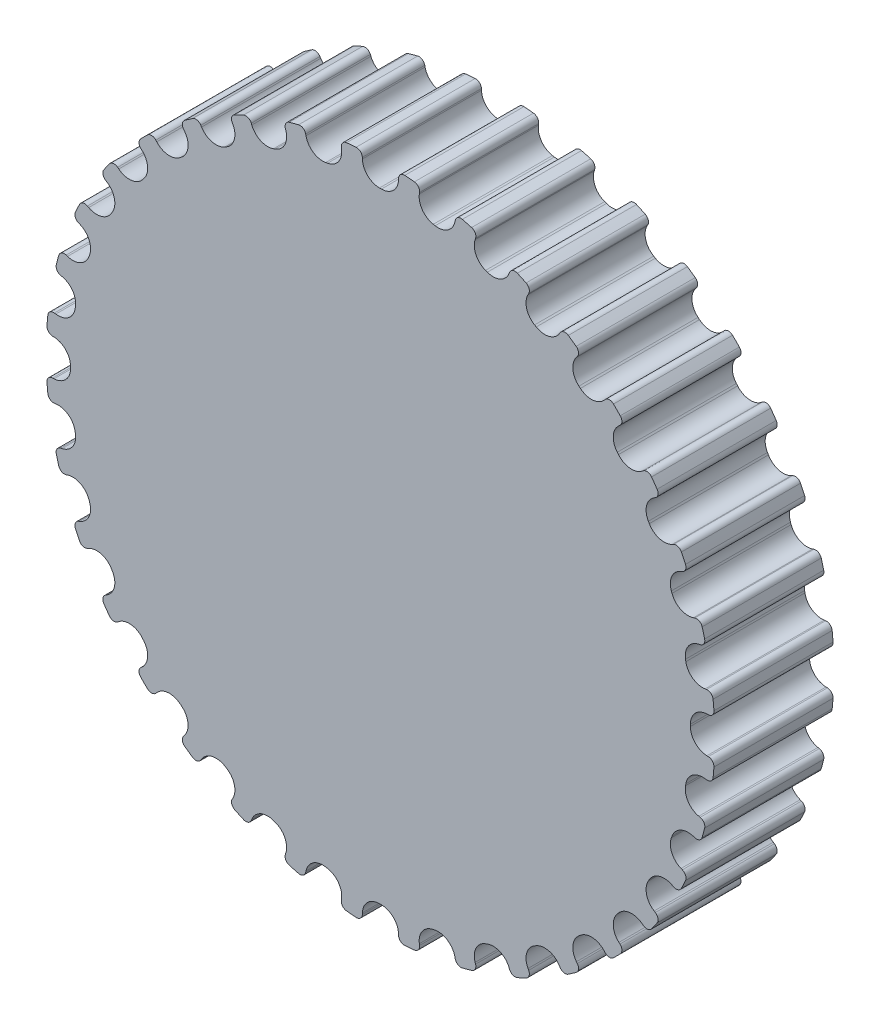
from build123d import *

# Parameters (mm, degrees)
EXTRUDE_7817_DEPTH = 5


with BuildPart() as part:
    # 草图1 → Extrude 7817 (new, symmetric)
    with BuildSketch(Plane.XY):
        with BuildLine():
            Line((0.081, 26.023889757), (-0.081, 26.023889757))
            ThreePointArc((-0.081, 26.023889757), (-1.079918737, 26.427479124), (-1.518124009, 27.41170428))
            Line((-1.518124009, 27.41170428), (-1.522310858, 27.531599943))
            ThreePointArc((-1.522310858, 27.531599943), (-1.684042167, 27.877730986), (-2.045568553, 28.001272023))
            ThreePointArc((-2.045568553, 28.001272023), (-2.219797894, 27.987998909), (-2.393941254, 27.973641717))
            ThreePointArc((-2.393941254, 27.973641717), (-2.446975025, 27.96905252), (-2.5, 27.964362779))
            ThreePointArc((-2.5, 27.964362779), (-2.673990831, 27.948262176), (-2.847878089, 27.931079034))
            ThreePointArc((-2.847878089, 27.931079034), (-3.182459401, 27.746636465), (-3.281628623, 27.377679583))
            Line((-3.281628623, 27.377679583), (-3.264932201, 27.258878366))
            ThreePointArc((-3.264932201, 27.258878366), (-3.525571246, 26.213512254), (-4.439231604, 25.642593898))
            Line((-4.439231604, 25.642593898), (-4.59877046, 25.614462893))
            ThreePointArc((-4.59877046, 25.614462893), (-5.652595935, 25.838460413), (-6.255052789, 26.731639431))
            Line((-6.255052789, 26.731639431), (-6.279995694, 26.84898657))
            ThreePointArc((-6.279995694, 26.84898657), (-6.499374966, 27.161774758), (-6.876861629, 27.220660531))
            ThreePointArc((-6.876861629, 27.220660531), (-7.046139183, 27.177334458), (-7.215143814, 27.132955706))
            ThreePointArc((-7.215143814, 27.132955706), (-7.266574977, 27.119227012), (-7.317980019, 27.105400828))
            ThreePointArc((-7.317980019, 27.105400828), (-7.486531698, 27.059331639), (-7.654793396, 27.012214342))
            ThreePointArc((-7.654793396, 27.012214342), (-7.95226355, 26.772474435), (-7.985857479, 26.391902283))
            Line((-7.985857479, 26.391902283), (-7.948785098, 26.277805227))
            ThreePointArc((-7.948785098, 26.277805227), (-8.02393853, 25.20306108), (-8.824579402, 24.4821608))
            Line((-8.824579402, 24.4821608), (-8.976809607, 24.426753537))
            ThreePointArc((-8.976809607, 24.426753537), (-10.053521866, 24.464353157), (-10.801924956, 25.239347244))
            Line((-10.801924956, 25.239347244), (-10.846866038, 25.350580327))
            ThreePointArc((-10.846866038, 25.350580327), (-11.117227545, 25.620521749), (-11.499204745, 25.612963043))
            ThreePointArc((-11.499204745, 25.612963043), (-11.658387099, 25.540900452), (-11.81711788, 25.467848567))
            ThreePointArc((-11.81711788, 25.467848567), (-11.865383726, 25.445397514), (-11.913606918, 25.42285499))
            ThreePointArc((-11.913606918, 25.42285499), (-12.071598087, 25.348217003), (-12.22912168, 25.272597187))
            ThreePointArc((-12.22912168, 25.272597187), (-12.480442196, 24.984844318), (-12.447440096, 24.604220386))
            Line((-12.447440096, 24.604220386), (-12.391118182, 24.498294272))
            ThreePointArc((-12.391118182, 24.498294272), (-12.278502502, 23.426827647), (-12.941796821, 22.577849634))
            Line((-12.941796821, 22.577849634), (-13.082092936, 22.496849634))
            ThreePointArc((-13.082092936, 22.496849634), (-14.148976622, 22.346908911), (-15.020586098, 22.980170263))
            Line((-15.020586098, 22.980170263), (-15.084159847, 23.081909528))
            ThreePointArc((-15.084159847, 23.081909528), (-15.397288791, 23.300802151), (-15.772150344, 23.227028634))
            ThreePointArc((-15.772150344, 23.227028634), (-15.916400822, 23.128419109), (-16.060034799, 23.028913736))
            ThreePointArc((-16.060034799, 23.028913736), (-16.103668794, 22.998422489), (-16.147244899, 22.967848567))
            ThreePointArc((-16.147244899, 22.967848567), (-16.289875077, 22.86690962), (-16.431874289, 22.765084954))
            ThreePointArc((-16.431874289, 22.765084954), (-16.62940892, 22.438062348), (-16.530813545, 22.068951704))
            Line((-16.530813545, 22.068951704), (-16.456953411, 21.974415043))
            ThreePointArc((-16.456953411, 21.974415043), (-16.159990389, 20.938781912), (-16.665784291, 19.987521933))
            Line((-16.665784291, 19.987521933), (-16.789883491, 19.88339034))
            ThreePointArc((-16.789883491, 19.88339034), (-17.814521883, 19.550465145), (-18.782854333, 20.022752437))
            Line((-18.782854333, 20.022752437), (-18.863129092, 20.111906589))
            ThreePointArc((-18.863129092, 20.111906589), (-19.209511208, 20.27309947), (-19.565867135, 20.135352713))
            ThreePointArc((-19.565867135, 20.135352713), (-19.69080276, 20.013192456), (-19.814975688, 19.890257015))
            ThreePointArc((-19.814975688, 19.890257015), (-19.852652035, 19.852652035), (-19.890257015, 19.814975688))
            ThreePointArc((-19.890257015, 19.814975688), (-20.013192456, 19.69080276), (-20.135352713, 19.565867135))
            ThreePointArc((-20.135352713, 19.565867135), (-20.27309947, 19.209511208), (-20.111906589, 18.863129092))
            Line((-20.111906589, 18.863129092), (-20.022752437, 18.782854333))
            ThreePointArc((-20.022752437, 18.782854333), (-19.550465145, 17.814521883), (-19.88339034, 16.789883491))
            Line((-19.88339034, 16.789883491), (-19.987521933, 16.665784291))
            ThreePointArc((-19.987521933, 16.665784291), (-20.938781912, 16.159990389), (-21.974415043, 16.456953411))
            Line((-21.974415043, 16.456953411), (-22.068951704, 16.530813545))
            ThreePointArc((-22.068951704, 16.530813545), (-22.438062348, 16.62940892), (-22.765084954, 16.431874289))
            ThreePointArc((-22.765084954, 16.431874289), (-22.86690962, 16.289875077), (-22.967848567, 16.147244899))
            ThreePointArc((-22.967848567, 16.147244899), (-22.998422489, 16.103668794), (-23.028913736, 16.060034799))
            ThreePointArc((-23.028913736, 16.060034799), (-23.128419109, 15.916400822), (-23.227028634, 15.772150344))
            ThreePointArc((-23.227028634, 15.772150344), (-23.300802151, 15.397288791), (-23.081909528, 15.084159847))
            Line((-23.081909528, 15.084159847), (-22.980170263, 15.020586098))
            ThreePointArc((-22.980170263, 15.020586098), (-22.346908911, 14.148976622), (-22.496849634, 13.082092936))
            Line((-22.496849634, 13.082092936), (-22.577849634, 12.941796821))
            ThreePointArc((-22.577849634, 12.941796821), (-23.426827647, 12.278502502), (-24.498294272, 12.391118182))
            Line((-24.498294272, 12.391118182), (-24.604220386, 12.447440096))
            ThreePointArc((-24.604220386, 12.447440096), (-24.984844318, 12.480442196), (-25.272597187, 12.22912168))
            ThreePointArc((-25.272597187, 12.22912168), (-25.348217003, 12.071598087), (-25.42285499, 11.913606918))
            ThreePointArc((-25.42285499, 11.913606918), (-25.445397514, 11.865383726), (-25.467848567, 11.81711788))
            ThreePointArc((-25.467848567, 11.81711788), (-25.540900452, 11.658387099), (-25.612963043, 11.499204745))
            ThreePointArc((-25.612963043, 11.499204745), (-25.620521749, 11.117227545), (-25.350580327, 10.846866038))
            Line((-25.350580327, 10.846866038), (-25.239347244, 10.801924956))
            ThreePointArc((-25.239347244, 10.801924956), (-24.464353157, 10.053521866), (-24.426753537, 8.976809607))
            Line((-24.426753537, 8.976809607), (-24.4821608, 8.824579402))
            ThreePointArc((-24.4821608, 8.824579402), (-25.20306108, 8.02393853), (-26.277805227, 7.948785098))
            Line((-26.277805227, 7.948785098), (-26.391902283, 7.985857479))
            ThreePointArc((-26.391902283, 7.985857479), (-26.772474435, 7.95226355), (-27.012214342, 7.654793396))
            ThreePointArc((-27.012214342, 7.654793396), (-27.059331639, 7.486531698), (-27.105400828, 7.317980019))
            ThreePointArc((-27.105400828, 7.317980019), (-27.119227012, 7.266574977), (-27.132955706, 7.215143814))
            ThreePointArc((-27.132955706, 7.215143814), (-27.177334458, 7.046139183), (-27.220660531, 6.876861629))
            ThreePointArc((-27.220660531, 6.876861629), (-27.161774758, 6.499374966), (-26.84898657, 6.279995694))
            Line((-26.84898657, 6.279995694), (-26.731639431, 6.255052789))
            ThreePointArc((-26.731639431, 6.255052789), (-25.838460413, 5.652595935), (-25.614462893, 4.59877046))
            Line((-25.614462893, 4.59877046), (-25.642593898, 4.439231604))
            ThreePointArc((-25.642593898, 4.439231604), (-26.213512254, 3.525571246), (-27.258878366, 3.264932201))
            Line((-27.258878366, 3.264932201), (-27.377679583, 3.281628623))
            ThreePointArc((-27.377679583, 3.281628623), (-27.746636465, 3.182459401), (-27.931079034, 2.847878089))
            ThreePointArc((-27.931079034, 2.847878089), (-27.948262176, 2.673990831), (-27.964362779, 2.5))
            ThreePointArc((-27.964362779, 2.5), (-27.96905252, 2.446975025), (-27.973641717, 2.393941254))
            ThreePointArc((-27.973641717, 2.393941254), (-27.987998909, 2.219797894), (-28.001272023, 2.045568553))
            ThreePointArc((-28.001272023, 2.045568553), (-27.877730986, 1.684042167), (-27.531599943, 1.522310858))
            Line((-27.531599943, 1.522310858), (-27.41170428, 1.518124009))
            ThreePointArc((-27.41170428, 1.518124009), (-26.427479124, 1.079918737), (-26.023889757, 0.081))
            Line((-26.023889757, 0.081), (-26.023889757, -0.081))
            ThreePointArc((-26.023889757, -0.081), (-26.427479124, -1.079918737), (-27.41170428, -1.518124009))
            Line((-27.41170428, -1.518124009), (-27.531599943, -1.522310858))
            ThreePointArc((-27.531599943, -1.522310858), (-27.877730986, -1.684042167), (-28.001272023, -2.045568553))
            ThreePointArc((-28.001272023, -2.045568553), (-27.987998909, -2.219797894), (-27.973641717, -2.393941254))
            ThreePointArc((-27.973641717, -2.393941254), (-27.96905252, -2.446975025), (-27.964362779, -2.5))
            ThreePointArc((-27.964362779, -2.5), (-27.948262176, -2.673990831), (-27.931079034, -2.847878089))
            ThreePointArc((-27.931079034, -2.847878089), (-27.746636465, -3.182459401), (-27.377679583, -3.281628623))
            Line((-27.377679583, -3.281628623), (-27.258878366, -3.264932201))
            ThreePointArc((-27.258878366, -3.264932201), (-26.213512254, -3.525571246), (-25.642593898, -4.439231604))
            Line((-25.642593898, -4.439231604), (-25.614462893, -4.59877046))
            ThreePointArc((-25.614462893, -4.59877046), (-25.838460413, -5.652595935), (-26.731639431, -6.255052789))
            Line((-26.731639431, -6.255052789), (-26.84898657, -6.279995694))
            ThreePointArc((-26.84898657, -6.279995694), (-27.161774758, -6.499374966), (-27.220660531, -6.876861629))
            ThreePointArc((-27.220660531, -6.876861629), (-27.177334458, -7.046139183), (-27.132955706, -7.215143814))
            ThreePointArc((-27.132955706, -7.215143814), (-27.119227012, -7.266574977), (-27.105400828, -7.317980019))
            ThreePointArc((-27.105400828, -7.317980019), (-27.059331639, -7.486531698), (-27.012214342, -7.654793396))
            ThreePointArc((-27.012214342, -7.654793396), (-26.772474435, -7.95226355), (-26.391902283, -7.985857479))
            Line((-26.391902283, -7.985857479), (-26.277805227, -7.948785098))
            ThreePointArc((-26.277805227, -7.948785098), (-25.20306108, -8.02393853), (-24.4821608, -8.824579402))
            Line((-24.4821608, -8.824579402), (-24.426753537, -8.976809607))
            ThreePointArc((-24.426753537, -8.976809607), (-24.464353157, -10.053521866), (-25.239347244, -10.801924956))
            Line((-25.239347244, -10.801924956), (-25.350580327, -10.846866038))
            ThreePointArc((-25.350580327, -10.846866038), (-25.620521749, -11.117227545), (-25.612963043, -11.499204745))
            ThreePointArc((-25.612963043, -11.499204745), (-25.540900452, -11.658387099), (-25.467848567, -11.81711788))
            ThreePointArc((-25.467848567, -11.81711788), (-25.445397514, -11.865383726), (-25.42285499, -11.913606918))
            ThreePointArc((-25.42285499, -11.913606918), (-25.348217003, -12.071598087), (-25.272597187, -12.22912168))
            ThreePointArc((-25.272597187, -12.22912168), (-24.984844318, -12.480442196), (-24.604220386, -12.447440096))
            Line((-24.604220386, -12.447440096), (-24.498294272, -12.391118182))
            ThreePointArc((-24.498294272, -12.391118182), (-23.426827647, -12.278502502), (-22.577849634, -12.941796821))
            Line((-22.577849634, -12.941796821), (-22.496849634, -13.082092936))
            ThreePointArc((-22.496849634, -13.082092936), (-22.346908911, -14.148976622), (-22.980170263, -15.020586098))
            Line((-22.980170263, -15.020586098), (-23.081909528, -15.084159847))
            ThreePointArc((-23.081909528, -15.084159847), (-23.300802151, -15.397288791), (-23.227028634, -15.772150344))
            ThreePointArc((-23.227028634, -15.772150344), (-23.128419109, -15.916400822), (-23.028913736, -16.060034799))
            ThreePointArc((-23.028913736, -16.060034799), (-22.998422489, -16.103668794), (-22.967848567, -16.147244899))
            ThreePointArc((-22.967848567, -16.147244899), (-22.86690962, -16.289875077), (-22.765084954, -16.431874289))
            ThreePointArc((-22.765084954, -16.431874289), (-22.438062348, -16.62940892), (-22.068951704, -16.530813545))
            Line((-22.068951704, -16.530813545), (-21.974415043, -16.456953411))
            ThreePointArc((-21.974415043, -16.456953411), (-20.938781912, -16.159990389), (-19.987521933, -16.665784291))
            Line((-19.987521933, -16.665784291), (-19.88339034, -16.789883491))
            ThreePointArc((-19.88339034, -16.789883491), (-19.550465145, -17.814521883), (-20.022752437, -18.782854333))
            Line((-20.022752437, -18.782854333), (-20.111906589, -18.863129092))
            ThreePointArc((-20.111906589, -18.863129092), (-20.27309947, -19.209511208), (-20.135352713, -19.565867135))
            ThreePointArc((-20.135352713, -19.565867135), (-20.013192456, -19.69080276), (-19.890257015, -19.814975688))
            ThreePointArc((-19.890257015, -19.814975688), (-19.852652035, -19.852652035), (-19.814975688, -19.890257015))
            ThreePointArc((-19.814975688, -19.890257015), (-19.69080276, -20.013192456), (-19.565867135, -20.135352713))
            ThreePointArc((-19.565867135, -20.135352713), (-19.209511208, -20.27309947), (-18.863129092, -20.111906589))
            Line((-18.863129092, -20.111906589), (-18.782854333, -20.022752437))
            ThreePointArc((-18.782854333, -20.022752437), (-17.814521883, -19.550465145), (-16.789883491, -19.88339034))
            Line((-16.789883491, -19.88339034), (-16.665784291, -19.987521933))
            ThreePointArc((-16.665784291, -19.987521933), (-16.159990389, -20.938781912), (-16.456953411, -21.974415043))
            Line((-16.456953411, -21.974415043), (-16.530813545, -22.068951704))
            ThreePointArc((-16.530813545, -22.068951704), (-16.62940892, -22.438062348), (-16.431874289, -22.765084954))
            ThreePointArc((-16.431874289, -22.765084954), (-16.289875077, -22.86690962), (-16.147244899, -22.967848567))
            ThreePointArc((-16.147244899, -22.967848567), (-16.103668794, -22.998422489), (-16.060034799, -23.028913736))
            ThreePointArc((-16.060034799, -23.028913736), (-15.916400822, -23.128419109), (-15.772150344, -23.227028634))
            ThreePointArc((-15.772150344, -23.227028634), (-15.397288791, -23.300802151), (-15.084159847, -23.081909528))
            Line((-15.084159847, -23.081909528), (-15.020586098, -22.980170263))
            ThreePointArc((-15.020586098, -22.980170263), (-14.148976622, -22.346908911), (-13.082092936, -22.496849634))
            Line((-13.082092936, -22.496849634), (-12.941796821, -22.577849634))
            ThreePointArc((-12.941796821, -22.577849634), (-12.278502502, -23.426827647), (-12.391118182, -24.498294272))
            Line((-12.391118182, -24.498294272), (-12.447440096, -24.604220386))
            ThreePointArc((-12.447440096, -24.604220386), (-12.480442196, -24.984844318), (-12.22912168, -25.272597187))
            ThreePointArc((-12.22912168, -25.272597187), (-12.071598087, -25.348217003), (-11.913606918, -25.42285499))
            ThreePointArc((-11.913606918, -25.42285499), (-11.865383726, -25.445397514), (-11.81711788, -25.467848567))
            ThreePointArc((-11.81711788, -25.467848567), (-11.658387099, -25.540900452), (-11.499204745, -25.612963043))
            ThreePointArc((-11.499204745, -25.612963043), (-11.117227545, -25.620521749), (-10.846866038, -25.350580327))
            Line((-10.846866038, -25.350580327), (-10.801924956, -25.239347244))
            ThreePointArc((-10.801924956, -25.239347244), (-10.053521866, -24.464353157), (-8.976809607, -24.426753537))
            Line((-8.976809607, -24.426753537), (-8.824579402, -24.4821608))
            ThreePointArc((-8.824579402, -24.4821608), (-8.02393853, -25.20306108), (-7.948785098, -26.277805227))
            Line((-7.948785098, -26.277805227), (-7.985857479, -26.391902283))
            ThreePointArc((-7.985857479, -26.391902283), (-7.95226355, -26.772474435), (-7.654793396, -27.012214342))
            ThreePointArc((-7.654793396, -27.012214342), (-7.486531698, -27.059331639), (-7.317980019, -27.105400828))
            ThreePointArc((-7.317980019, -27.105400828), (-7.266574977, -27.119227012), (-7.215143814, -27.132955706))
            ThreePointArc((-7.215143814, -27.132955706), (-7.046139183, -27.177334458), (-6.876861629, -27.220660531))
            ThreePointArc((-6.876861629, -27.220660531), (-6.499374966, -27.161774758), (-6.279995694, -26.84898657))
            Line((-6.279995694, -26.84898657), (-6.255052789, -26.731639431))
            ThreePointArc((-6.255052789, -26.731639431), (-5.652595935, -25.838460413), (-4.59877046, -25.614462893))
            Line((-4.59877046, -25.614462893), (-4.439231604, -25.642593898))
            ThreePointArc((-4.439231604, -25.642593898), (-3.525571246, -26.213512254), (-3.264932201, -27.258878366))
            Line((-3.264932201, -27.258878366), (-3.281628623, -27.377679583))
            ThreePointArc((-3.281628623, -27.377679583), (-3.182459401, -27.746636465), (-2.847878089, -27.931079034))
            ThreePointArc((-2.847878089, -27.931079034), (-2.673990831, -27.948262176), (-2.5, -27.964362779))
            ThreePointArc((-2.5, -27.964362779), (-2.446975025, -27.96905252), (-2.393941254, -27.973641717))
            ThreePointArc((-2.393941254, -27.973641717), (-2.219797894, -27.987998909), (-2.045568553, -28.001272023))
            ThreePointArc((-2.045568553, -28.001272023), (-1.684042167, -27.877730986), (-1.522310858, -27.531599943))
            Line((-1.522310858, -27.531599943), (-1.518124009, -27.41170428))
            ThreePointArc((-1.518124009, -27.41170428), (-1.079918737, -26.427479124), (-0.081, -26.023889757))
            Line((-0.081, -26.023889757), (0.081, -26.023889757))
            ThreePointArc((0.081, -26.023889757), (1.079918737, -26.427479124), (1.518124009, -27.41170428))
            Line((1.518124009, -27.41170428), (1.522310858, -27.531599943))
            ThreePointArc((1.522310858, -27.531599943), (1.684042167, -27.877730986), (2.045568553, -28.001272023))
            ThreePointArc((2.045568553, -28.001272023), (2.219797894, -27.987998909), (2.393941254, -27.973641717))
            ThreePointArc((2.393941254, -27.973641717), (2.446975025, -27.96905252), (2.5, -27.964362779))
            ThreePointArc((2.5, -27.964362779), (2.673990831, -27.948262176), (2.847878089, -27.931079034))
            ThreePointArc((2.847878089, -27.931079034), (3.182459401, -27.746636465), (3.281628623, -27.377679583))
            Line((3.281628623, -27.377679583), (3.264932201, -27.258878366))
            ThreePointArc((3.264932201, -27.258878366), (3.525571246, -26.213512254), (4.439231604, -25.642593898))
            Line((4.439231604, -25.642593898), (4.59877046, -25.614462893))
            ThreePointArc((4.59877046, -25.614462893), (5.652595935, -25.838460413), (6.255052789, -26.731639431))
            Line((6.255052789, -26.731639431), (6.279995694, -26.84898657))
            ThreePointArc((6.279995694, -26.84898657), (6.499374966, -27.161774758), (6.876861629, -27.220660531))
            ThreePointArc((6.876861629, -27.220660531), (7.046139183, -27.177334458), (7.215143814, -27.132955706))
            ThreePointArc((7.215143814, -27.132955706), (7.266574977, -27.119227012), (7.317980019, -27.105400828))
            ThreePointArc((7.317980019, -27.105400828), (7.486531698, -27.059331639), (7.654793396, -27.012214342))
            ThreePointArc((7.654793396, -27.012214342), (7.95226355, -26.772474435), (7.985857479, -26.391902283))
            Line((7.985857479, -26.391902283), (7.948785098, -26.277805227))
            ThreePointArc((7.948785098, -26.277805227), (8.02393853, -25.20306108), (8.824579402, -24.4821608))
            Line((8.824579402, -24.4821608), (8.976809607, -24.426753537))
            ThreePointArc((8.976809607, -24.426753537), (10.053521866, -24.464353157), (10.801924956, -25.239347244))
            Line((10.801924956, -25.239347244), (10.846866038, -25.350580327))
            ThreePointArc((10.846866038, -25.350580327), (11.117227545, -25.620521749), (11.499204745, -25.612963043))
            ThreePointArc((11.499204745, -25.612963043), (11.658387099, -25.540900452), (11.81711788, -25.467848567))
            ThreePointArc((11.81711788, -25.467848567), (11.865383726, -25.445397514), (11.913606918, -25.42285499))
            ThreePointArc((11.913606918, -25.42285499), (12.071598087, -25.348217003), (12.22912168, -25.272597187))
            ThreePointArc((12.22912168, -25.272597187), (12.480442196, -24.984844318), (12.447440096, -24.604220386))
            Line((12.447440096, -24.604220386), (12.391118182, -24.498294272))
            ThreePointArc((12.391118182, -24.498294272), (12.278502502, -23.426827647), (12.941796821, -22.577849634))
            Line((12.941796821, -22.577849634), (13.082092936, -22.496849634))
            ThreePointArc((13.082092936, -22.496849634), (14.148976622, -22.346908911), (15.020586098, -22.980170263))
            Line((15.020586098, -22.980170263), (15.084159847, -23.081909528))
            ThreePointArc((15.084159847, -23.081909528), (15.397288791, -23.300802151), (15.772150344, -23.227028634))
            ThreePointArc((15.772150344, -23.227028634), (15.916400822, -23.128419109), (16.060034799, -23.028913736))
            ThreePointArc((16.060034799, -23.028913736), (16.103668794, -22.998422489), (16.147244899, -22.967848567))
            ThreePointArc((16.147244899, -22.967848567), (16.289875077, -22.86690962), (16.431874289, -22.765084954))
            ThreePointArc((16.431874289, -22.765084954), (16.62940892, -22.438062348), (16.530813545, -22.068951704))
            Line((16.530813545, -22.068951704), (16.456953411, -21.974415043))
            ThreePointArc((16.456953411, -21.974415043), (16.159990389, -20.938781912), (16.665784291, -19.987521933))
            Line((16.665784291, -19.987521933), (16.789883491, -19.88339034))
            ThreePointArc((16.789883491, -19.88339034), (17.814521883, -19.550465145), (18.782854333, -20.022752437))
            Line((18.782854333, -20.022752437), (18.863129092, -20.111906589))
            ThreePointArc((18.863129092, -20.111906589), (19.209511208, -20.27309947), (19.565867135, -20.135352713))
            ThreePointArc((19.565867135, -20.135352713), (19.69080276, -20.013192456), (19.814975688, -19.890257015))
            ThreePointArc((19.814975688, -19.890257015), (19.852652035, -19.852652035), (19.890257015, -19.814975688))
            ThreePointArc((19.890257015, -19.814975688), (20.013192456, -19.69080276), (20.135352713, -19.565867135))
            ThreePointArc((20.135352713, -19.565867135), (20.27309947, -19.209511208), (20.111906589, -18.863129092))
            Line((20.111906589, -18.863129092), (20.022752437, -18.782854333))
            ThreePointArc((20.022752437, -18.782854333), (19.550465145, -17.814521883), (19.88339034, -16.789883491))
            Line((19.88339034, -16.789883491), (19.987521933, -16.665784291))
            ThreePointArc((19.987521933, -16.665784291), (20.938781912, -16.159990389), (21.974415043, -16.456953411))
            Line((21.974415043, -16.456953411), (22.068951704, -16.530813545))
            ThreePointArc((22.068951704, -16.530813545), (22.438062348, -16.62940892), (22.765084954, -16.431874289))
            ThreePointArc((22.765084954, -16.431874289), (22.86690962, -16.289875077), (22.967848567, -16.147244899))
            ThreePointArc((22.967848567, -16.147244899), (22.998422489, -16.103668794), (23.028913736, -16.060034799))
            ThreePointArc((23.028913736, -16.060034799), (23.128419109, -15.916400822), (23.227028634, -15.772150344))
            ThreePointArc((23.227028634, -15.772150344), (23.300802151, -15.397288791), (23.081909528, -15.084159847))
            Line((23.081909528, -15.084159847), (22.980170263, -15.020586098))
            ThreePointArc((22.980170263, -15.020586098), (22.346908911, -14.148976622), (22.496849634, -13.082092936))
            Line((22.496849634, -13.082092936), (22.577849634, -12.941796821))
            ThreePointArc((22.577849634, -12.941796821), (23.426827647, -12.278502502), (24.498294272, -12.391118182))
            Line((24.498294272, -12.391118182), (24.604220386, -12.447440096))
            ThreePointArc((24.604220386, -12.447440096), (24.984844318, -12.480442196), (25.272597187, -12.22912168))
            ThreePointArc((25.272597187, -12.22912168), (25.348217003, -12.071598087), (25.42285499, -11.913606918))
            ThreePointArc((25.42285499, -11.913606918), (25.445397514, -11.865383726), (25.467848567, -11.81711788))
            ThreePointArc((25.467848567, -11.81711788), (25.540900452, -11.658387099), (25.612963043, -11.499204745))
            ThreePointArc((25.612963043, -11.499204745), (25.620521749, -11.117227545), (25.350580327, -10.846866038))
            Line((25.350580327, -10.846866038), (25.239347244, -10.801924956))
            ThreePointArc((25.239347244, -10.801924956), (24.464353157, -10.053521866), (24.426753537, -8.976809607))
            Line((24.426753537, -8.976809607), (24.4821608, -8.824579402))
            ThreePointArc((24.4821608, -8.824579402), (25.20306108, -8.02393853), (26.277805227, -7.948785098))
            Line((26.277805227, -7.948785098), (26.391902283, -7.985857479))
            ThreePointArc((26.391902283, -7.985857479), (26.772474435, -7.95226355), (27.012214342, -7.654793396))
            ThreePointArc((27.012214342, -7.654793396), (27.059331639, -7.486531698), (27.105400828, -7.317980019))
            ThreePointArc((27.105400828, -7.317980019), (27.119227012, -7.266574977), (27.132955706, -7.215143814))
            ThreePointArc((27.132955706, -7.215143814), (27.177334458, -7.046139183), (27.220660531, -6.876861629))
            ThreePointArc((27.220660531, -6.876861629), (27.161774758, -6.499374966), (26.84898657, -6.279995694))
            Line((26.84898657, -6.279995694), (26.731639431, -6.255052789))
            ThreePointArc((26.731639431, -6.255052789), (25.838460413, -5.652595935), (25.614462893, -4.59877046))
            Line((25.614462893, -4.59877046), (25.642593898, -4.439231604))
            ThreePointArc((25.642593898, -4.439231604), (26.213512254, -3.525571246), (27.258878366, -3.264932201))
            Line((27.258878366, -3.264932201), (27.377679583, -3.281628623))
            ThreePointArc((27.377679583, -3.281628623), (27.746636465, -3.182459401), (27.931079034, -2.847878089))
            ThreePointArc((27.931079034, -2.847878089), (27.948262176, -2.673990831), (27.964362779, -2.5))
            ThreePointArc((27.964362779, -2.5), (27.96905252, -2.446975025), (27.973641717, -2.393941254))
            ThreePointArc((27.973641717, -2.393941254), (27.987998909, -2.219797894), (28.001272023, -2.045568553))
            ThreePointArc((28.001272023, -2.045568553), (27.877730986, -1.684042167), (27.531599943, -1.522310858))
            Line((27.531599943, -1.522310858), (27.41170428, -1.518124009))
            ThreePointArc((27.41170428, -1.518124009), (26.427479124, -1.079918737), (26.023889757, -0.081))
            Line((26.023889757, -0.081), (26.023889757, 0.081))
            ThreePointArc((26.023889757, 0.081), (26.427479124, 1.079918737), (27.41170428, 1.518124009))
            Line((27.41170428, 1.518124009), (27.531599943, 1.522310858))
            ThreePointArc((27.531599943, 1.522310858), (27.877730986, 1.684042167), (28.001272023, 2.045568553))
            ThreePointArc((28.001272023, 2.045568553), (27.987998909, 2.219797894), (27.973641717, 2.393941254))
            ThreePointArc((27.973641717, 2.393941254), (27.96905252, 2.446975025), (27.964362779, 2.5))
            ThreePointArc((27.964362779, 2.5), (27.948262176, 2.673990831), (27.931079034, 2.847878089))
            ThreePointArc((27.931079034, 2.847878089), (27.746636465, 3.182459401), (27.377679583, 3.281628623))
            Line((27.377679583, 3.281628623), (27.258878366, 3.264932201))
            ThreePointArc((27.258878366, 3.264932201), (26.213512254, 3.525571246), (25.642593898, 4.439231604))
            Line((25.642593898, 4.439231604), (25.614462893, 4.59877046))
            ThreePointArc((25.614462893, 4.59877046), (25.838460413, 5.652595935), (26.731639431, 6.255052789))
            Line((26.731639431, 6.255052789), (26.84898657, 6.279995694))
            ThreePointArc((26.84898657, 6.279995694), (27.161774758, 6.499374966), (27.220660531, 6.876861629))
            ThreePointArc((27.220660531, 6.876861629), (27.177334458, 7.046139183), (27.132955706, 7.215143814))
            ThreePointArc((27.132955706, 7.215143814), (27.119227012, 7.266574977), (27.105400828, 7.317980019))
            ThreePointArc((27.105400828, 7.317980019), (27.059331639, 7.486531698), (27.012214342, 7.654793396))
            ThreePointArc((27.012214342, 7.654793396), (26.772474435, 7.95226355), (26.391902283, 7.985857479))
            Line((26.391902283, 7.985857479), (26.277805227, 7.948785098))
            ThreePointArc((26.277805227, 7.948785098), (25.20306108, 8.02393853), (24.4821608, 8.824579402))
            Line((24.4821608, 8.824579402), (24.426753537, 8.976809607))
            ThreePointArc((24.426753537, 8.976809607), (24.464353157, 10.053521866), (25.239347244, 10.801924956))
            Line((25.239347244, 10.801924956), (25.350580327, 10.846866038))
            ThreePointArc((25.350580327, 10.846866038), (25.620521749, 11.117227545), (25.612963043, 11.499204745))
            ThreePointArc((25.612963043, 11.499204745), (25.540900452, 11.658387099), (25.467848567, 11.81711788))
            ThreePointArc((25.467848567, 11.81711788), (25.445397514, 11.865383726), (25.42285499, 11.913606918))
            ThreePointArc((25.42285499, 11.913606918), (25.348217003, 12.071598087), (25.272597187, 12.22912168))
            ThreePointArc((25.272597187, 12.22912168), (24.984844318, 12.480442196), (24.604220386, 12.447440096))
            Line((24.604220386, 12.447440096), (24.498294272, 12.391118182))
            ThreePointArc((24.498294272, 12.391118182), (23.426827647, 12.278502502), (22.577849634, 12.941796821))
            Line((22.577849634, 12.941796821), (22.496849634, 13.082092936))
            ThreePointArc((22.496849634, 13.082092936), (22.346908911, 14.148976622), (22.980170263, 15.020586098))
            Line((22.980170263, 15.020586098), (23.081909528, 15.084159847))
            ThreePointArc((23.081909528, 15.084159847), (23.300802151, 15.397288791), (23.227028634, 15.772150344))
            ThreePointArc((23.227028634, 15.772150344), (23.128419109, 15.916400822), (23.028913736, 16.060034799))
            ThreePointArc((23.028913736, 16.060034799), (22.998422489, 16.103668794), (22.967848567, 16.147244899))
            ThreePointArc((22.967848567, 16.147244899), (22.86690962, 16.289875077), (22.765084954, 16.431874289))
            ThreePointArc((22.765084954, 16.431874289), (22.438062348, 16.62940892), (22.068951704, 16.530813545))
            Line((22.068951704, 16.530813545), (21.974415043, 16.456953411))
            ThreePointArc((21.974415043, 16.456953411), (20.938781912, 16.159990389), (19.987521933, 16.665784291))
            Line((19.987521933, 16.665784291), (19.88339034, 16.789883491))
            ThreePointArc((19.88339034, 16.789883491), (19.550465145, 17.814521883), (20.022752437, 18.782854333))
            Line((20.022752437, 18.782854333), (20.111906589, 18.863129092))
            ThreePointArc((20.111906589, 18.863129092), (20.27309947, 19.209511208), (20.135352713, 19.565867135))
            ThreePointArc((20.135352713, 19.565867135), (20.013192456, 19.69080276), (19.890257015, 19.814975688))
            ThreePointArc((19.890257015, 19.814975688), (19.852652035, 19.852652035), (19.814975688, 19.890257015))
            ThreePointArc((19.814975688, 19.890257015), (19.69080276, 20.013192456), (19.565867135, 20.135352713))
            ThreePointArc((19.565867135, 20.135352713), (19.209511208, 20.27309947), (18.863129092, 20.111906589))
            Line((18.863129092, 20.111906589), (18.782854333, 20.022752437))
            ThreePointArc((18.782854333, 20.022752437), (17.814521883, 19.550465145), (16.789883491, 19.88339034))
            Line((16.789883491, 19.88339034), (16.665784291, 19.987521933))
            ThreePointArc((16.665784291, 19.987521933), (16.159990389, 20.938781912), (16.456953411, 21.974415043))
            Line((16.456953411, 21.974415043), (16.530813545, 22.068951704))
            ThreePointArc((16.530813545, 22.068951704), (16.62940892, 22.438062348), (16.431874289, 22.765084954))
            ThreePointArc((16.431874289, 22.765084954), (16.289875077, 22.86690962), (16.147244899, 22.967848567))
            ThreePointArc((16.147244899, 22.967848567), (16.103668794, 22.998422489), (16.060034799, 23.028913736))
            ThreePointArc((16.060034799, 23.028913736), (15.916400822, 23.128419109), (15.772150344, 23.227028634))
            ThreePointArc((15.772150344, 23.227028634), (15.397288791, 23.300802151), (15.084159847, 23.081909528))
            Line((15.084159847, 23.081909528), (15.020586098, 22.980170263))
            ThreePointArc((15.020586098, 22.980170263), (14.148976622, 22.346908911), (13.082092936, 22.496849634))
            Line((13.082092936, 22.496849634), (12.941796821, 22.577849634))
            ThreePointArc((12.941796821, 22.577849634), (12.278502502, 23.426827647), (12.391118182, 24.498294272))
            Line((12.391118182, 24.498294272), (12.447440096, 24.604220386))
            ThreePointArc((12.447440096, 24.604220386), (12.480442196, 24.984844318), (12.22912168, 25.272597187))
            ThreePointArc((12.22912168, 25.272597187), (12.071598087, 25.348217003), (11.913606918, 25.42285499))
            ThreePointArc((11.913606918, 25.42285499), (11.865383726, 25.445397514), (11.81711788, 25.467848567))
            ThreePointArc((11.81711788, 25.467848567), (11.658387099, 25.540900452), (11.499204745, 25.612963043))
            ThreePointArc((11.499204745, 25.612963043), (11.117227545, 25.620521749), (10.846866038, 25.350580327))
            Line((10.846866038, 25.350580327), (10.801924956, 25.239347244))
            ThreePointArc((10.801924956, 25.239347244), (10.053521866, 24.464353157), (8.976809607, 24.426753537))
            Line((8.976809607, 24.426753537), (8.824579402, 24.4821608))
            ThreePointArc((8.824579402, 24.4821608), (8.02393853, 25.20306108), (7.948785098, 26.277805227))
            Line((7.948785098, 26.277805227), (7.985857479, 26.391902283))
            ThreePointArc((7.985857479, 26.391902283), (7.95226355, 26.772474435), (7.654793396, 27.012214342))
            ThreePointArc((7.654793396, 27.012214342), (7.486531698, 27.059331639), (7.317980019, 27.105400828))
            ThreePointArc((7.317980019, 27.105400828), (7.266574977, 27.119227012), (7.215143814, 27.132955706))
            ThreePointArc((7.215143814, 27.132955706), (7.046139183, 27.177334458), (6.876861629, 27.220660531))
            ThreePointArc((6.876861629, 27.220660531), (6.499374966, 27.161774758), (6.279995694, 26.84898657))
            Line((6.279995694, 26.84898657), (6.255052789, 26.731639431))
            ThreePointArc((6.255052789, 26.731639431), (5.652595935, 25.838460413), (4.59877046, 25.614462893))
            Line((4.59877046, 25.614462893), (4.439231604, 25.642593898))
            ThreePointArc((4.439231604, 25.642593898), (3.525571246, 26.213512254), (3.264932201, 27.258878366))
            Line((3.264932201, 27.258878366), (3.281628623, 27.377679583))
            ThreePointArc((3.281628623, 27.377679583), (3.182459401, 27.746636465), (2.847878089, 27.931079034))
            ThreePointArc((2.847878089, 27.931079034), (2.673990831, 27.948262176), (2.5, 27.964362779))
            ThreePointArc((2.5, 27.964362779), (2.446975025, 27.96905252), (2.393941254, 27.973641717))
            ThreePointArc((2.393941254, 27.973641717), (2.219797894, 27.987998909), (2.045568553, 28.001272023))
            ThreePointArc((2.045568553, 28.001272023), (1.684042167, 27.877730986), (1.522310858, 27.531599943))
            Line((1.522310858, 27.531599943), (1.518124009, 27.41170428))
            ThreePointArc((1.518124009, 27.41170428), (1.079918737, 26.427479124), (0.081, 26.023889757))
        make_face()
    extrude(amount=EXTRUDE_7817_DEPTH, both=True)


solid = part.part
